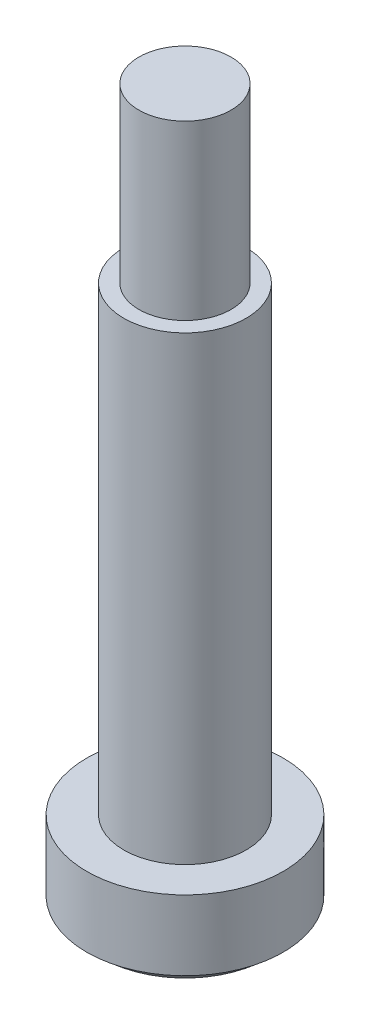
from build123d import *

# Parameters (mm, degrees)
SKETCH_1_R          = 6.4
EXTRUDE_1_DEPTH     = 5.4
SKETCH_2_R          = 3.985
EXTRUDE_2_DEPTH     = 30
SKETCH_3_R          = 3
EXTRUDE_3_DEPTH     = 11.25
CHAMFER_1_SIZE      = 1
CHAMFER_1_SIZE2     = 0.839099631
CUT_EXTRUDE_1_DEPTH = 3


with BuildPart() as part:
    # 草图1 → 凸台-拉伸1 (new body)
    with BuildSketch(Plane(origin=(0, 0, 0), x_dir=(1, 0, 0), z_dir=(0, 1, 0))):
        with Locations(Location((0, 0, 0), (0, 0, 90))):
            Circle(SKETCH_1_R)
    extrude(amount=EXTRUDE_1_DEPTH)

    # 草图2 → 凸台-拉伸2 (add)
    with BuildSketch(Plane(origin=(0, 5.4, 0), x_dir=(1, 0, 0), z_dir=(0, 1, 0))):
        with Locations(Location((0, 0, 0), (0, 0, 270))):
            Circle(SKETCH_2_R)
    extrude(amount=EXTRUDE_2_DEPTH)

    # 草图3 → 凸台-拉伸3 (add)
    with BuildSketch(Plane(origin=(0, 35.4, 0), x_dir=(1, 0, 0), z_dir=(0, 1, 0))):
        with Locations(Location((0, 0, 0), (0, 0, 90))):
            Circle(SKETCH_3_R)
    extrude(amount=EXTRUDE_3_DEPTH)

    # 倒角1
    chamfer_1_edges = [part.edges().sort_by_distance(p)[0] for p in [
        (0, 0, 6.4),
    ]]
    chamfer_1_side = [part.faces().sort_by_distance(p)[0] for p in [
        (0, 0, 0),
    ]]
    chamfer(chamfer_1_edges, length=CHAMFER_1_SIZE, length2=CHAMFER_1_SIZE2, reference=chamfer_1_side[0])

    # 草图4 → 切除-拉伸1 (cut)
    with BuildSketch(Plane.XZ):
        Polygon((0, 2.309401077), (-2, 1.154700538), (-2, -1.154700538), (0, -2.309401077), (2, -1.154700538), (2, 1.154700538), align=None)
    extrude(amount=-CUT_EXTRUDE_1_DEPTH, mode=Mode.SUBTRACT)


solid = part.part
